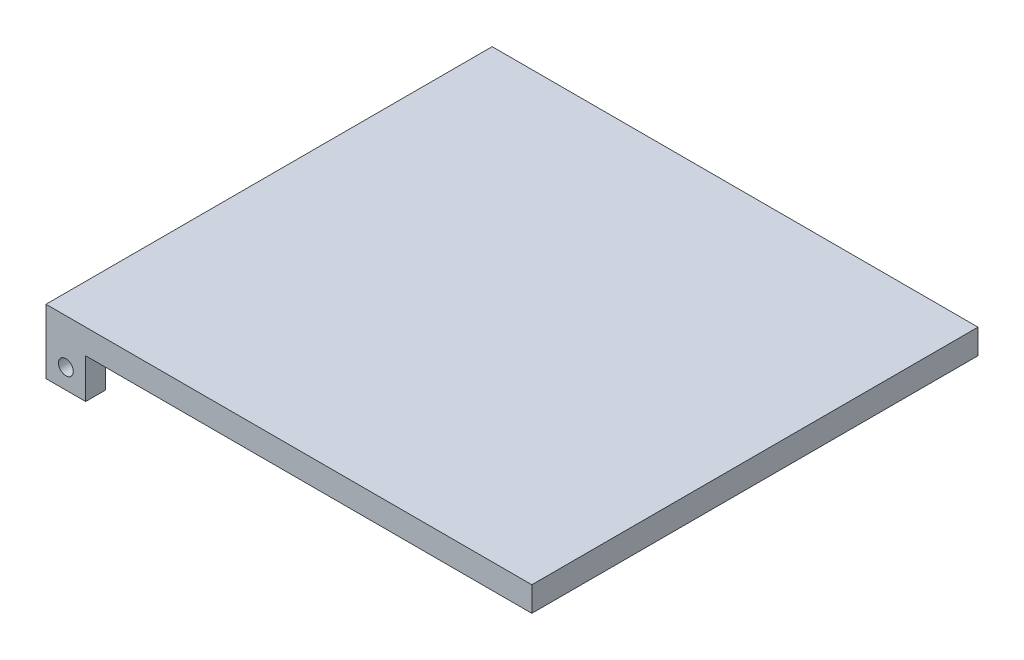
from build123d import *

# Parameters (mm, degrees)
SKETCH_1_W          = 39.2
SKETCH_1_H          = 36
EXTRUDE_1_DEPTH     = 2
SKETCH_7_W          = 3.2
SKETCH_7_H          = 1.6
EXTRUDE_3_DEPTH     = 3.2
CUT_EXTRUDE_START   = -36
SKETCH_8_R          = 0.6
CUT_EXTRUDE_2_DEPTH = 36


with BuildPart() as part:
    # Эскиз1 → Бобышка-Вытянуть1 (new body)
    with BuildSketch(Plane(origin=(0, 0, 0), x_dir=(1, 0, 0), z_dir=(0, 1, 0))):
        Rectangle(SKETCH_1_W, SKETCH_1_H)
    extrude(amount=EXTRUDE_1_DEPTH)

    # Эскиз7 → Бобышка-Вытянуть3 (add)
    with BuildSketch(Plane.XZ):
        with Locations((-18, -17.2)):
            Rectangle(SKETCH_7_W, SKETCH_7_H)
        with Locations((-18, 17.2)):
            Rectangle(SKETCH_7_W, SKETCH_7_H)
    extrude(amount=EXTRUDE_3_DEPTH)

    # Эскиз8 → Вырез-Вытянуть2 (cut)
    with BuildSketch(Plane(origin=(0, 0, -18), x_dir=(-1, 0, 0), z_dir=(0, 0, -1)).offset(CUT_EXTRUDE_START)):
        with Locations((18, -1.6)):
            Circle(SKETCH_8_R)
    extrude(amount=CUT_EXTRUDE_2_DEPTH, mode=Mode.SUBTRACT)


solid = part.part
